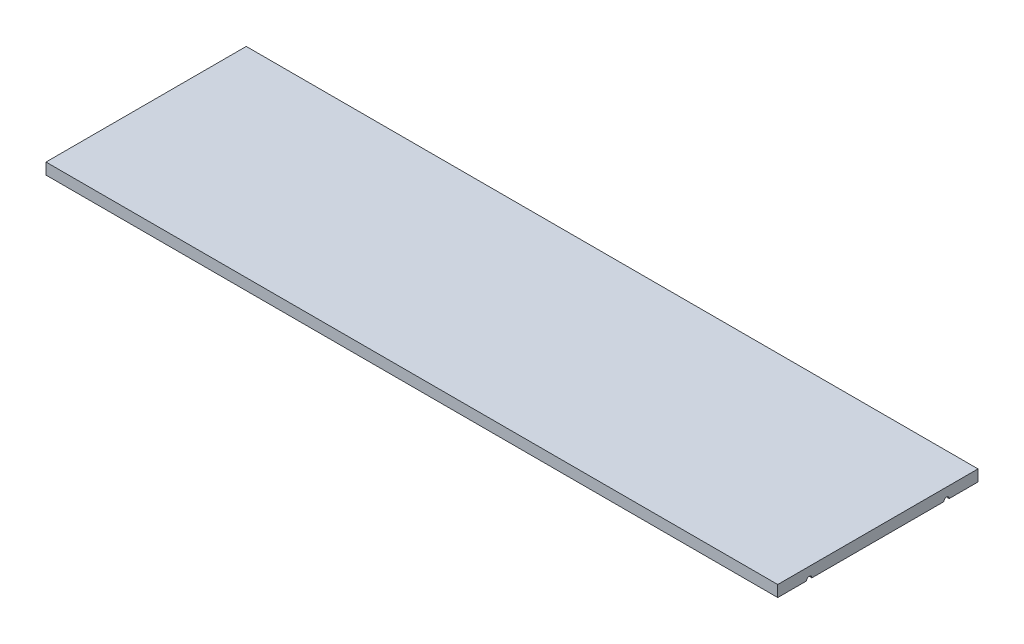
from build123d import *

# Parameters (mm, degrees)
SKETCH1_W       = 1162
SKETCH1_H       = 318
ADJ_SHELF_DEPTH = 18
SKETCH2_R       = 4.25
EXTRUDE3_DEPTH  = 18
EXTRUDE4_START  = -18
EXTRUDE4_DEPTH  = 18


with BuildPart() as part:
    # Sketch1 → Adj Shelf (new body)
    with BuildSketch(Plane(origin=(0, -18, 0), x_dir=(-1, 0, 0), z_dir=(0, 1, 0))):
        with Locations((581, -159)):
            Rectangle(SKETCH1_W, SKETCH1_H)
    extrude(amount=ADJ_SHELF_DEPTH)

    # Sketch2 → Extrude3 (cut)
    with BuildSketch(Plane(origin=(-1162, 0, 0), x_dir=(0, 0, -1), z_dir=(1, 0, 0))):
        with Locations((50, -18)):
            Circle(SKETCH2_R)
        with Locations((268, -18)):
            Circle(SKETCH2_R)
    extrude(amount=EXTRUDE3_DEPTH, mode=Mode.SUBTRACT)

    # Sketch4 → Extrude4 (cut)
    with BuildSketch(Plane(origin=(0, 0, 0), x_dir=(0, 0, -1), z_dir=(1, 0, 0)).offset(EXTRUDE4_START)):
        with BuildLine():
            Line((45.75, -18), (54.25, -18))
            ThreePointArc((54.25, -18), (50, -13.75), (45.75, -18))
        make_face()
        with BuildLine():
            Line((263.75, -18), (272.25, -18))
            ThreePointArc((272.25, -18), (268, -13.75), (263.75, -18))
        make_face()
    extrude(amount=EXTRUDE4_DEPTH, mode=Mode.SUBTRACT)


solid = part.part
